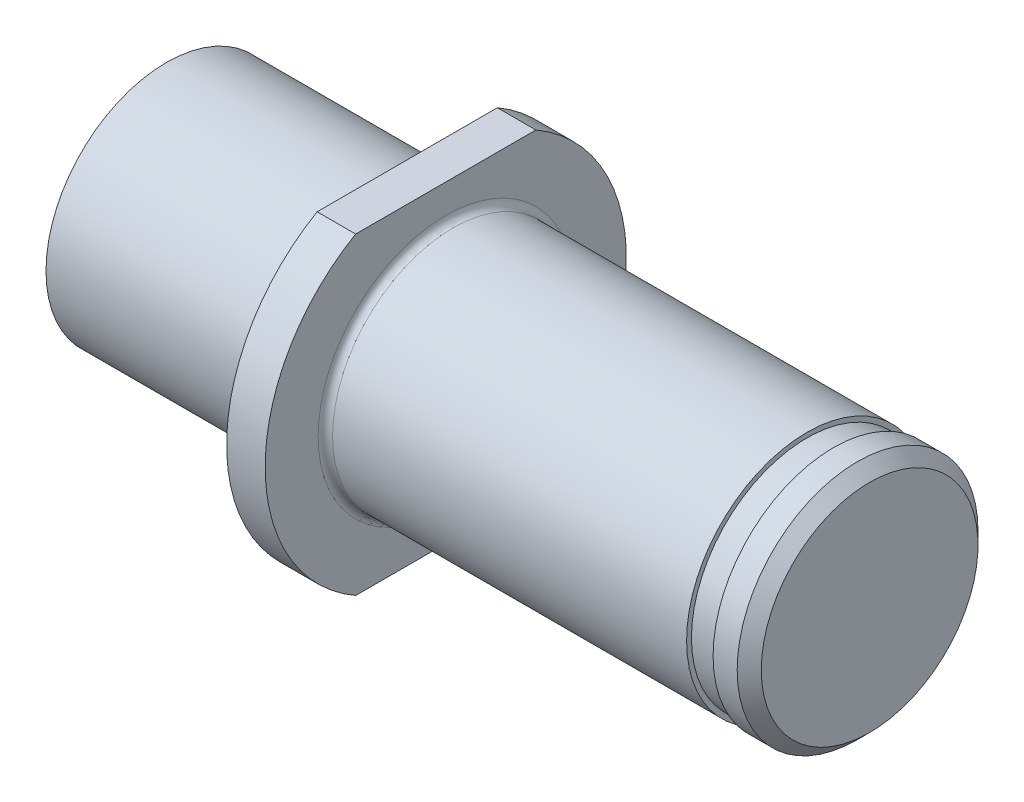
from build123d import *

# Parameters (mm, degrees)
SCHNITT_LINEAR_AUSTRAGEN2_DEPTH = 7.5


with BuildPart() as part:
    # Skizze1 → Rotation1 (revolve)
    with BuildSketch(Plane.XY, mode=Mode.PRIVATE) as rotation1_sk:
        with BuildLine():
            Line((14.3, 4.8), (15.4, 4.8))
            Line((15.4, 4.8), (15.4, 5))
            Line((15.4, 5), (16.4, 5))
            Line((16.4, 5), (16.9, 4.5))
            Line((16.9, 4.5), (16.9, 0))
            Line((16.9, 0), (-12.3, 0))
            Line((-12.3, 0), (-12.3, 5))
            Line((-12.3, 5), (-3.05, 5))
            Line((-3.05, 5), (-3.05, 4.25))
            Line((-3.05, 4.25), (-2.3, 4.25))
            Line((-2.3, 4.25), (-2.3, 7.5))
            Line((-2.3, 7.5), (-0.7, 7.5))
            Line((-0.7, 7.5), (-0.7, 5.3))
            ThreePointArc((-0.7, 5.3), (-0.612132034, 5.087867966), (-0.4, 5))
            Line((-0.4, 5), (14.3, 5))
            Line((14.3, 5), (14.3, 4.8))
        make_face()
    revolve(rotation1_sk.sketch.rotate(Axis((-55.671450842, 0, 0), (1, 0, 0)), 90), axis=Axis((-55.671450842, 0, 0), (1, 0, 0)))

    # Skizze5 → Schnitt-Linear austragen2 (cut, symmetric)
    with BuildSketch(Plane(origin=(0, 0, 0), x_dir=(0, 0, -1), z_dir=(1, 0, 0))):
        with BuildLine():
            Line((-3.741657387, 6.5), (3.741657387, 6.5))
            ThreePointArc((3.741657387, 6.5), (0, 7.5), (-3.741657387, 6.5))
        make_face()
        with BuildLine():
            Line((-3.741657387, -6.5), (3.741657387, -6.5))
            ThreePointArc((3.741657387, -6.5), (0, -7.5), (-3.741657387, -6.5))
        make_face()
    extrude(amount=SCHNITT_LINEAR_AUSTRAGEN2_DEPTH, both=True, mode=Mode.SUBTRACT)


solid = part.part
